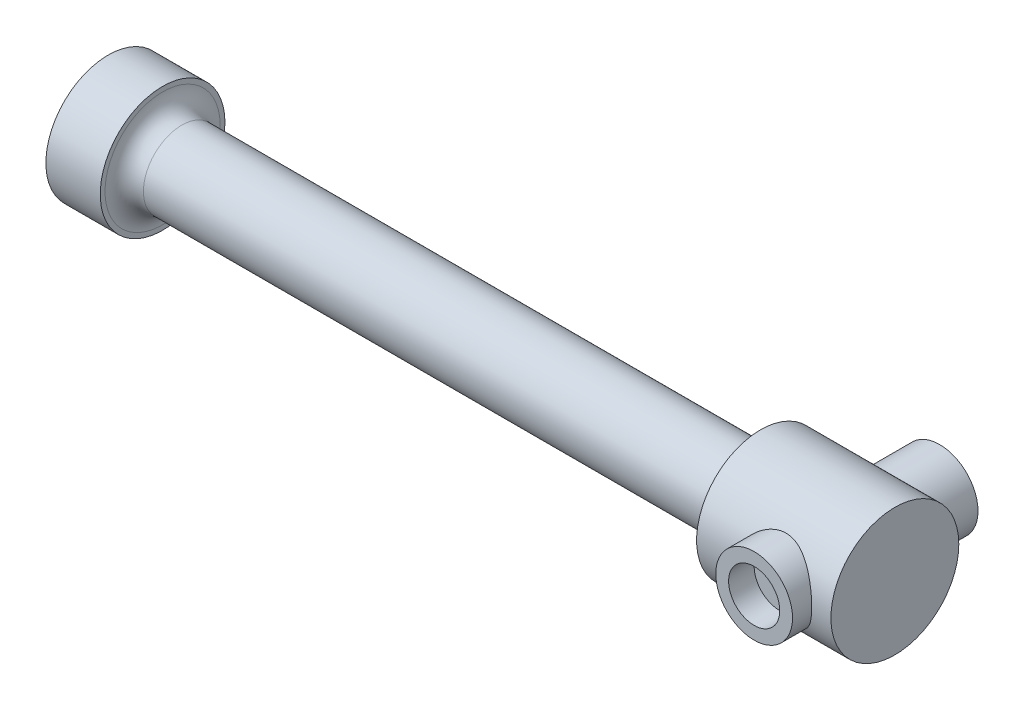
from build123d import *

# Parameters (mm, degrees)
SKETCH2_R                = 9.75
BOSS_EXTRUDE1_DEPTH      = 8.5
SKETCH3_R                = 6
BOSS_EXTRUDE2_DEPTH      = 93.5
FILLET1_R                = 3
SKETCH4_R                = 10
BOSS_EXTRUDE3_DEPTH      = 21
FILLET2_R                = 2
BOSS_EXTRUDE4_DEPTH      = 13
BOSS_EXTRUDE4_DEPTH_BACK = 16
SKETCH5_R                = 6
SKETCH6_R                = 4
CUT_EXTRUDE1_DEPTH       = 4
CUT_EXTRUDE2_REACH       = 127.913
SKETCH7_R                = 1.5
CUT_EXTRUDE3_START       = -4
SKETCH8_R                = 4
CUT_EXTRUDE3_DEPTH       = 4


with BuildPart() as part:
    # Sketch2 → Boss-Extrude1 (new body)
    with BuildSketch(Plane(origin=(0, 0, 0), x_dir=(0, 0, -1), z_dir=(1, 0, 0))):
        Circle(SKETCH2_R)
    extrude(amount=BOSS_EXTRUDE1_DEPTH)

    # Sketch3 → Boss-Extrude2 (add)
    with BuildSketch(Plane(origin=(8.5, 0, 0), x_dir=(0, 0, -1), z_dir=(1, 0, 0))):
        Circle(SKETCH3_R)
    extrude(amount=BOSS_EXTRUDE2_DEPTH)

    # Fillet1
    fillet1_edges = [part.edges().sort_by_distance(p)[0] for p in [
        (8.5, 0, 6),
    ]]
    fillet(fillet1_edges, radius=FILLET1_R)

    # Sketch4 → Boss-Extrude3 (add)
    with BuildSketch(Plane(origin=(102, 0, 0), x_dir=(0, 0, -1), z_dir=(1, 0, 0))):
        with Locations(Location((0, 0, 0), (0, 0, 180))):
            Circle(SKETCH4_R)
    extrude(amount=BOSS_EXTRUDE3_DEPTH)

    # Fillet2
    fillet2_edges = [part.edges().sort_by_distance(p)[0] for p in [
        (102, 0, 6),
    ]]
    fillet(fillet2_edges, radius=FILLET2_R)

    # Sketch5 → Boss-Extrude4 (add, two sides: drawn at the far end of the back side and taken through both)
    with BuildSketch(Plane.XY.offset(-BOSS_EXTRUDE4_DEPTH_BACK)):
        with Locations((114, 0)):
            Circle(SKETCH5_R)
    extrude(amount=BOSS_EXTRUDE4_DEPTH + BOSS_EXTRUDE4_DEPTH_BACK)

    # Sketch6 → Cut-Extrude1 (cut)
    with BuildSketch(Plane.XY.offset(13)):
        with Locations((114, 0)):
            Circle(SKETCH6_R)
    extrude(amount=-CUT_EXTRUDE1_DEPTH, mode=Mode.SUBTRACT)

    # Sketch7 → Cut-Extrude2 (cut, up to next)
    with BuildSketch(Plane.XY.offset(9), mode=Mode.PRIVATE) as cut_extrude2_sk1:
        with Locations((114, 0)):
            Circle(SKETCH7_R)
    cut_extrude2_tool1 = extrude(cut_extrude2_sk1.sketch, amount=-CUT_EXTRUDE2_REACH, mode=Mode.PRIVATE) & part.part
    add(cut_extrude2_tool1.solids().sort_by_distance((114, 0, 9))[0], mode=Mode.SUBTRACT)

    # Sketch8 → Cut-Extrude3 (cut)
    with BuildSketch(Plane(origin=(0, 0, -16), x_dir=(-1, 0, 0), z_dir=(0, 0, -1)).offset(CUT_EXTRUDE3_START)):
        with Locations(Location((-114, 0, 0), (0, 0, 180))):
            Circle(SKETCH8_R)
    extrude(amount=CUT_EXTRUDE3_DEPTH, mode=Mode.SUBTRACT)


solid = part.part
